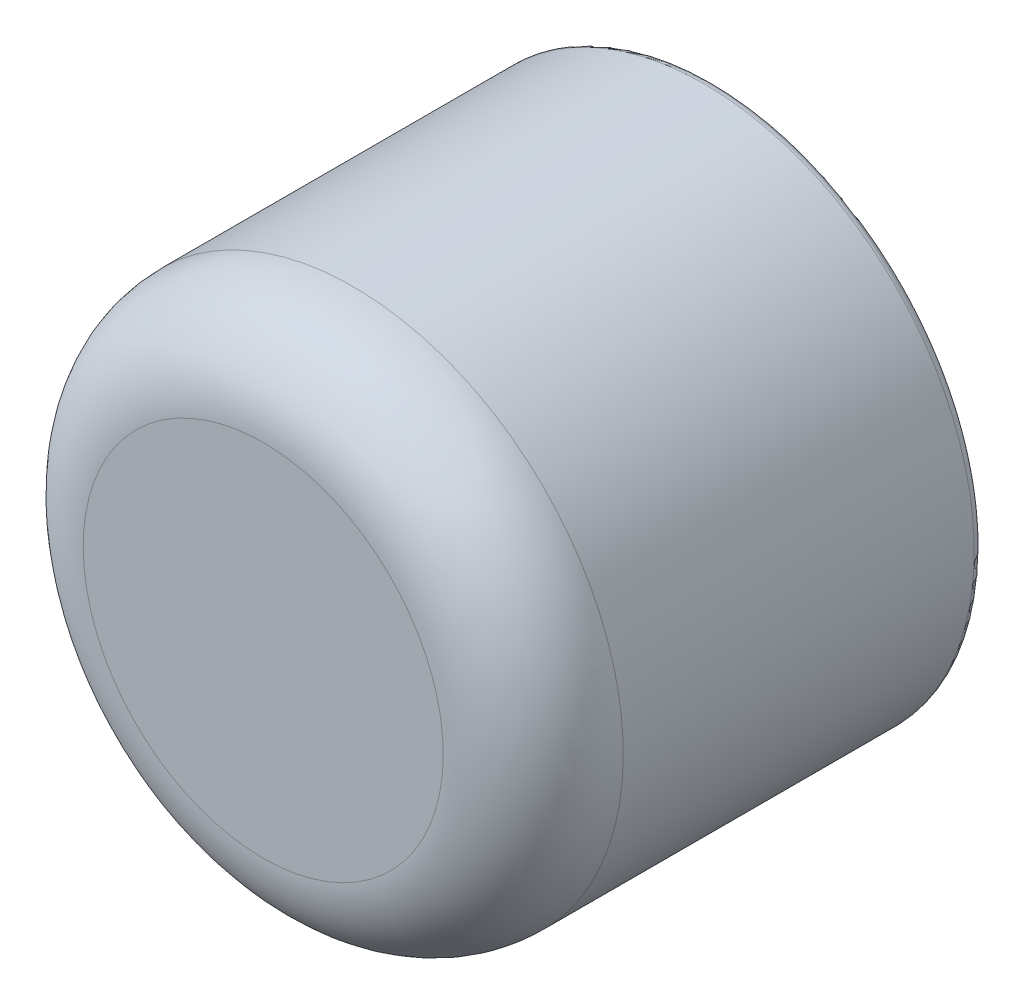
from build123d import *

# Parameters (mm, degrees)
SKETCH1_W = 15
SKETCH1_H = 25
FILLET1_R = 5
FILLET2_R = 0.5


with BuildPart() as part:
    # Sketch1 → Revolve1 (revolve)
    with BuildSketch(Plane.YZ, mode=Mode.PRIVATE) as revolve1_sk:
        with Locations((7.5, 0)):
            Rectangle(SKETCH1_W, SKETCH1_H)
    revolve(revolve1_sk.sketch.rotate(Axis((0, 0, 22.327044025), (0, 0, -1)), 180), axis=Axis((0, 0, 22.327044025), (0, 0, -1)))

    # Fillet1
    fillet1_edges = [part.edges().sort_by_distance(p)[0] for p in [
        (0, 15, 12.5),
    ]]
    fillet(fillet1_edges, radius=FILLET1_R)

    # Fillet2
    fillet2_edges = [part.edges().sort_by_distance(p)[0] for p in [
        (0, 15, -12.5),
    ]]
    fillet(fillet2_edges, radius=FILLET2_R)


solid = part.part
